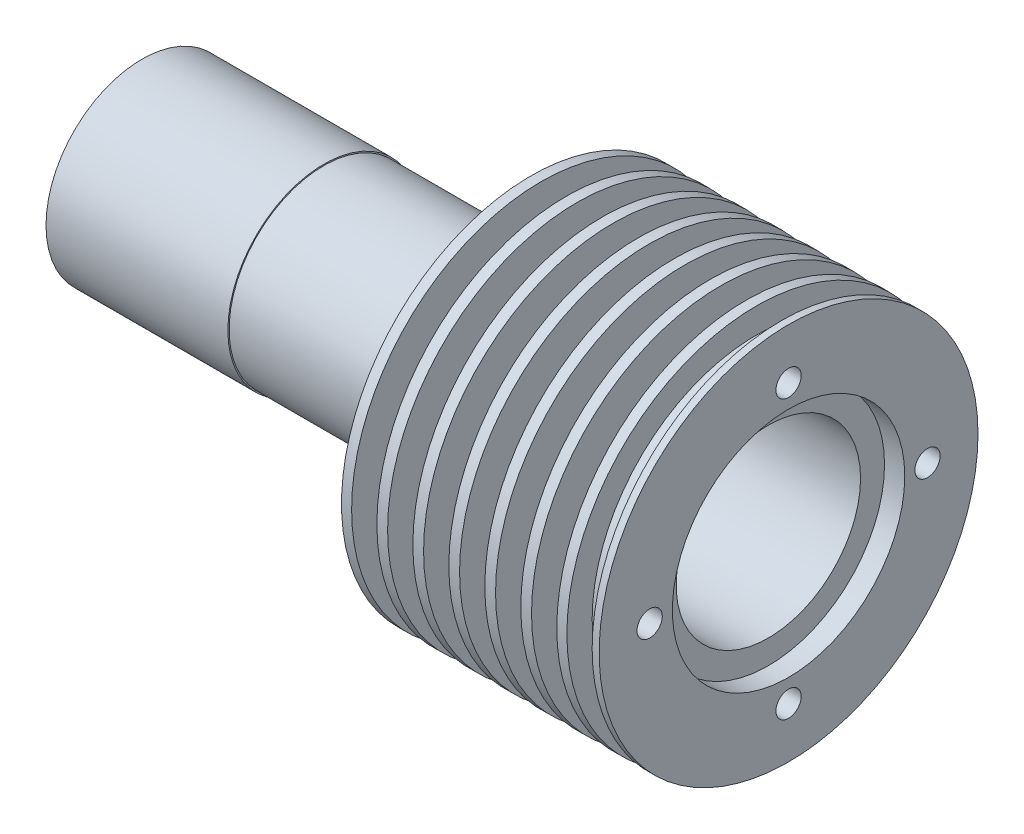
from build123d import *

# Parameters (mm, degrees)
SKETCH1_R           = 19
BOSS_EXTRUDE1_DEPTH = 36
SKETCH2_R           = 18.75
BOSS_EXTRUDE2_DEPTH = 36
SKETCH3_R           = 19
BOSS_EXTRUDE3_DEPTH = 56
SKETCH4_R           = 37.5
BOSS_EXTRUDE4_DEPTH = 51
SKETCH5_R           = 18.25
CUT_EXTRUDE1_DEPTH  = 139.551434493
SKETCH6_W           = 5
SKETCH6_H           = 18.5
SKETCH6_H_2         = 5
SKETCH7_R           = 2.5
CUT_EXTRUDE2_DEPTH  = 9
SKETCH8_R           = 23
CUT_EXTRUDE3_DEPTH  = 4


with BuildPart() as part:
    # Sketch1 → Boss-Extrude1 (new body)
    with BuildSketch(Plane(origin=(0, 0, 0), x_dir=(0, 0, -1), z_dir=(1, 0, 0))):
        Circle(SKETCH1_R)
    extrude(amount=BOSS_EXTRUDE1_DEPTH)

    # Sketch2 → Boss-Extrude2 (add)
    with BuildSketch(Plane(origin=(36, 0, 0), x_dir=(0, 0, -1), z_dir=(1, 0, 0))):
        Circle(SKETCH2_R)
    extrude(amount=BOSS_EXTRUDE2_DEPTH)

    # Sketch3 → Boss-Extrude3 (add)
    with BuildSketch(Plane(origin=(72, 0, 0), x_dir=(0, 0, -1), z_dir=(1, 0, 0))):
        Circle(SKETCH3_R)
    extrude(amount=BOSS_EXTRUDE3_DEPTH)

    # Sketch4 → Boss-Extrude4 (add)
    with BuildSketch(Plane(origin=(128, 0, 0), x_dir=(0, 0, -1), z_dir=(1, 0, 0))):
        Circle(SKETCH4_R)
    extrude(amount=-BOSS_EXTRUDE4_DEPTH)

    # Sketch5 → Cut-Extrude1 (cut, through all)
    with BuildSketch(Plane(origin=(128, 0, 0), x_dir=(0, 0, -1), z_dir=(1, 0, 0))):
        Circle(SKETCH5_R)
    extrude(amount=-CUT_EXTRUDE1_DEPTH, mode=Mode.SUBTRACT)

    # Sketch6 → Cut-Revolve1 (revolve, cut)
    with BuildSketch(Plane.XY, mode=Mode.PRIVATE) as cut_revolve1_sk:
        with Locations((81.5, 28.25)):
            Rectangle(SKETCH6_W, SKETCH6_H)
        with Locations((88.622995217, 28.25)):
            Rectangle(SKETCH6_W, SKETCH6_H)
        with Locations((95.745990433, 28.25)):
            Rectangle(SKETCH6_W, SKETCH6_H)
        with Locations((102.86898565, 28.25)):
            Rectangle(SKETCH6_W, SKETCH6_H)
        with Locations((109.991980867, 28.25)):
            Rectangle(SKETCH6_W, SKETCH6_H)
        with Locations((117.114976083, 28.25)):
            Rectangle(SKETCH6_W, SKETCH6_H)
        with Locations((124.114976083, 35)):
            Rectangle(SKETCH6_W, SKETCH6_H_2)
    revolve(cut_revolve1_sk.sketch.rotate(Axis((0, 0, 0), (1, 0, 0)), 90), axis=Axis((0, 0, 0), (1, 0, 0)), mode=Mode.SUBTRACT)

    # Sketch7 → Cut-Extrude2 (cut)
    with BuildSketch(Plane(origin=(128, 0, 0), x_dir=(0, 0, -1), z_dir=(1, 0, 0))):
        with Locations((0, 27.5)):
            Circle(SKETCH7_R)
        with Locations((27.5, 0)):
            Circle(SKETCH7_R)
        with Locations((0, -27.5)):
            Circle(SKETCH7_R)
        with Locations((-27.5, 0)):
            Circle(SKETCH7_R)
    extrude(amount=-CUT_EXTRUDE2_DEPTH, mode=Mode.SUBTRACT)

    # Sketch8 → Cut-Extrude3 (cut)
    with BuildSketch(Plane(origin=(128, 0, 0), x_dir=(0, 0, -1), z_dir=(1, 0, 0))):
        Circle(SKETCH8_R)
    extrude(amount=-CUT_EXTRUDE3_DEPTH, mode=Mode.SUBTRACT)


solid = part.part
